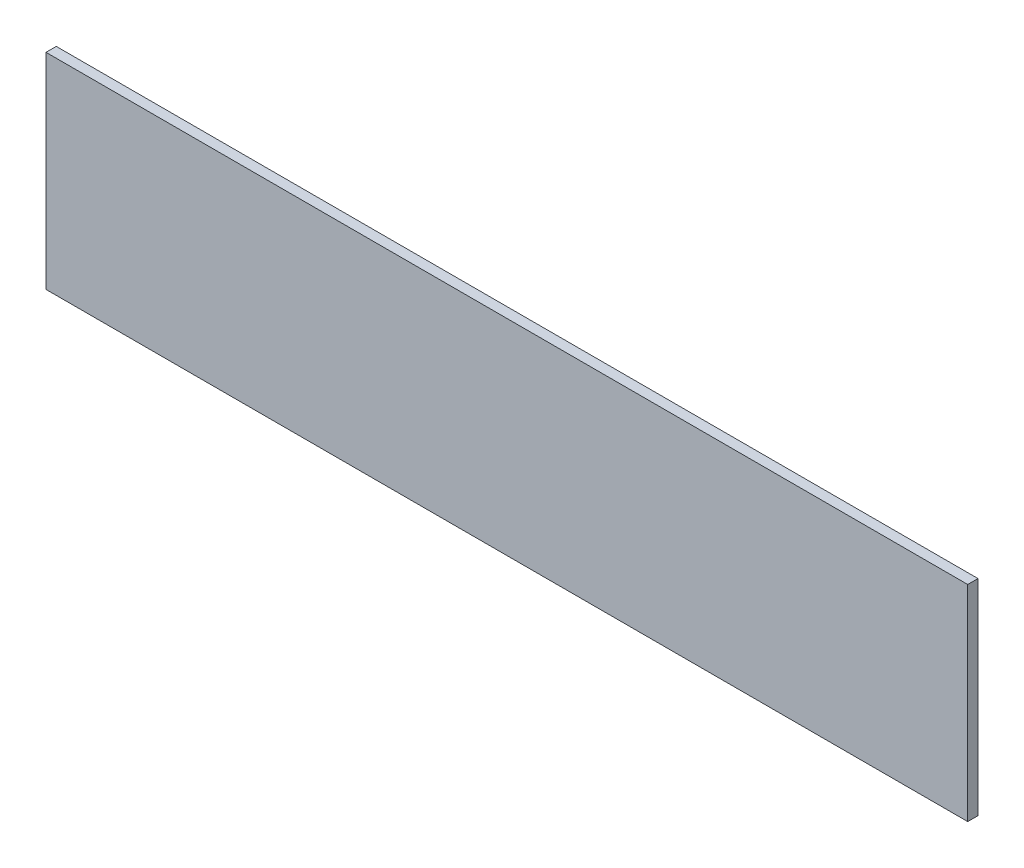
from build123d import *

# Parameters (mm, degrees)
ESQUISSE1_W        = 570
ESQUISSE1_H        = 127
BOSS_EXTRU_1_DEPTH = 3.175


with BuildPart() as part:
    # Esquisse1 → Boss.-Extru.1 (new, symmetric)
    with BuildSketch(Plane.XY):
        Rectangle(ESQUISSE1_W, ESQUISSE1_H)
    extrude(amount=BOSS_EXTRU_1_DEPTH, both=True)


solid = part.part
